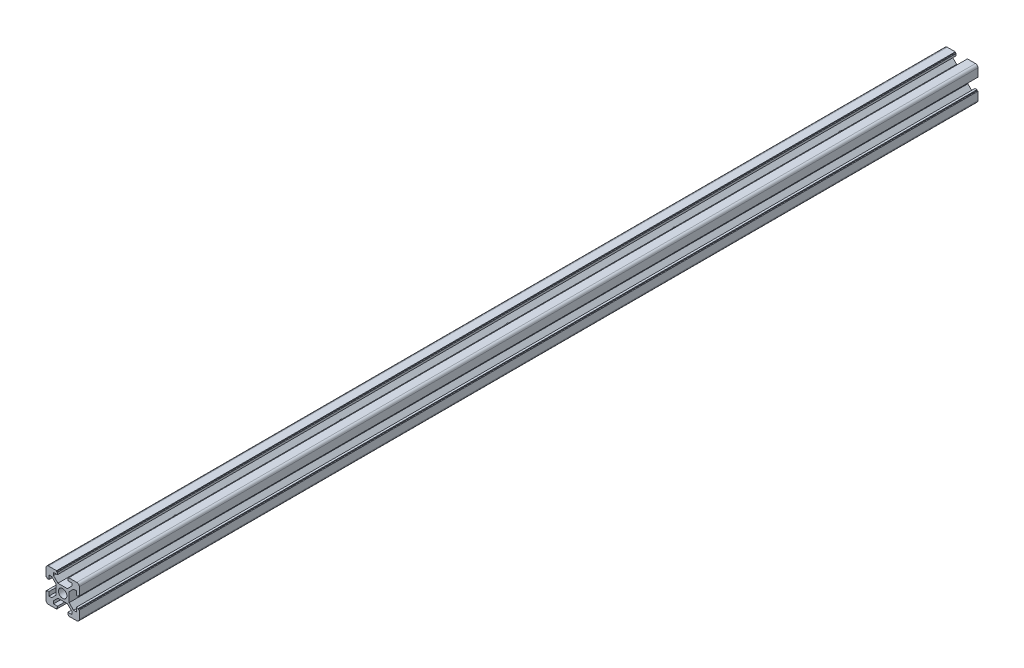
from build123d import *

# Parameters (mm, degrees)
SKETCH_2_R          = 2.55
EXTRUDE_1_DEPTH     = 540
SKETCH_4_R          = 3
CUT_EXTRUDE_2_DEPTH = 20


with BuildPart() as part:
    # 草图2 → 凸台-拉伸1 (new body)
    with BuildSketch(Plane.XY):
        with BuildLine():
            Line((-3.9, 2.839339828), (-6.560660172, 5.5))
            Line((-6.560660172, 5.5), (-8.2, 5.5))
            Line((-8.2, 5.5), (-8.2, 3.1))
            Line((-8.2, 3.1), (-9.45, 3.1))
            Line((-9.45, 3.1), (-9.45, 3.65))
            Line((-9.45, 3.65), (-10, 3.65))
            Line((-10, 3.65), (-10, 8.5))
            ThreePointArc((-10, 8.5), (-9.560660172, 9.560660172), (-8.5, 10))
            Line((-8.5, 10), (-3.65, 10))
            Line((-3.65, 10), (-3.65, 9.45))
            Line((-3.65, 9.45), (-3.1, 9.45))
            Line((-3.1, 9.45), (-3.1, 8.2))
            Line((-3.1, 8.2), (-5.5, 8.2))
            Line((-5.5, 8.2), (-5.5, 6.560660172))
            Line((-5.5, 6.560660172), (-2.839339828, 3.9))
            Line((-2.839339828, 3.9), (2.839339828, 3.9))
            Line((2.839339828, 3.9), (5.5, 6.560660172))
            Line((5.5, 6.560660172), (5.5, 8.2))
            Line((5.5, 8.2), (3.1, 8.2))
            Line((3.1, 8.2), (3.1, 9.45))
            Line((3.1, 9.45), (3.65, 9.45))
            Line((3.65, 9.45), (3.65, 10))
            Line((3.65, 10), (8.5, 10))
            ThreePointArc((8.5, 10), (9.560660172, 9.560660172), (10, 8.5))
            Line((10, 8.5), (10, 3.65))
            Line((10, 3.65), (9.45, 3.65))
            Line((9.45, 3.65), (9.45, 3.1))
            Line((9.45, 3.1), (8.2, 3.1))
            Line((8.2, 3.1), (8.2, 5.5))
            Line((8.2, 5.5), (6.560660172, 5.5))
            Line((6.560660172, 5.5), (3.9, 2.839339828))
            Line((3.9, 2.839339828), (3.9, -2.839339828))
            Line((3.9, -2.839339828), (6.560660172, -5.5))
            Line((6.560660172, -5.5), (8.2, -5.5))
            Line((8.2, -5.5), (8.2, -3.1))
            Line((8.2, -3.1), (9.45, -3.1))
            Line((9.45, -3.1), (9.45, -3.65))
            Line((9.45, -3.65), (10, -3.65))
            Line((10, -3.65), (10, -8.5))
            ThreePointArc((10, -8.5), (9.560660172, -9.560660172), (8.5, -10))
            Line((8.5, -10), (3.65, -10))
            Line((3.65, -10), (3.65, -9.45))
            Line((3.65, -9.45), (3.1, -9.45))
            Line((3.1, -9.45), (3.1, -8.2))
            Line((3.1, -8.2), (5.5, -8.2))
            Line((5.5, -8.2), (5.5, -6.560660172))
            Line((5.5, -6.560660172), (2.839339828, -3.9))
            Line((2.839339828, -3.9), (-2.839339828, -3.9))
            Line((-2.839339828, -3.9), (-5.5, -6.560660172))
            Line((-5.5, -6.560660172), (-5.5, -8.2))
            Line((-5.5, -8.2), (-3.1, -8.2))
            Line((-3.1, -8.2), (-3.1, -9.45))
            Line((-3.1, -9.45), (-3.65, -9.45))
            Line((-3.65, -9.45), (-3.65, -10))
            Line((-3.65, -10), (-8.5, -10))
            ThreePointArc((-8.5, -10), (-9.560660172, -9.560660172), (-10, -8.5))
            Line((-10, -8.5), (-10, -3.65))
            Line((-10, -3.65), (-9.45, -3.65))
            Line((-9.45, -3.65), (-9.45, -3.1))
            Line((-9.45, -3.1), (-8.2, -3.1))
            Line((-8.2, -3.1), (-8.2, -5.5))
            Line((-8.2, -5.5), (-6.560660172, -5.5))
            Line((-6.560660172, -5.5), (-3.9, -2.839339828))
            Line((-3.9, -2.839339828), (-3.9, 2.839339828))
        make_face()
        Circle(SKETCH_2_R, mode=Mode.SUBTRACT)
    extrude(amount=EXTRUDE_1_DEPTH)

    # 草图4 → 切除-拉伸2 (cut)
    with BuildSketch(Plane.XZ.offset(10)):
        with Locations(Location((0, 270, 0), (0, 0, 198.835996158))):
            Circle(SKETCH_4_R)
        with Locations(Location((0, 170, 0), (0, 0, 198.835996158))):
            Circle(SKETCH_4_R)
        with Locations(Location((0, 370, 0), (0, 0, 198.835996158))):
            Circle(SKETCH_4_R)
        with Locations(Location((0, 470, 0), (0, 0, 198.835996158))):
            Circle(SKETCH_4_R)
        with Locations(Location((0, 70, 0), (0, 0, 198.835996158))):
            Circle(SKETCH_4_R)
    extrude(amount=-CUT_EXTRUDE_2_DEPTH, mode=Mode.SUBTRACT)


solid = part.part
